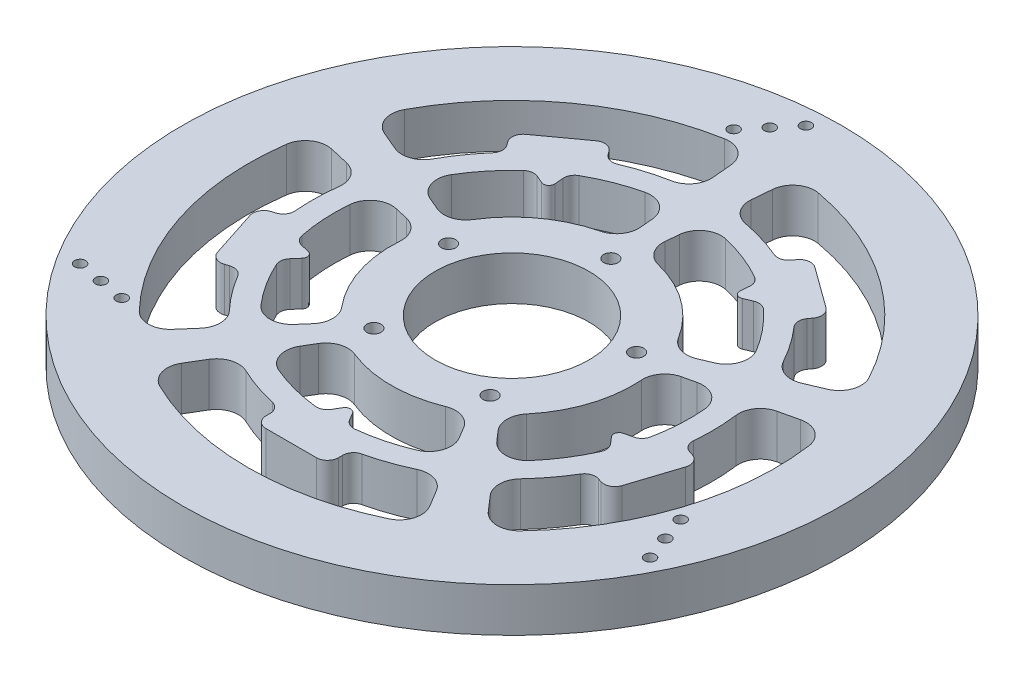
from build123d import *

# Parameters (mm, degrees)
SKETCH1_R           = 150
SKETCH1_R_2         = 35
BOSS_EXTRUDE1_DEPTH = 20
CUT_EXTRUDE6_START  = -214.072757527
SKETCH2_R           = 2.5
CUT_EXTRUDE6_DEPTH  = 234.072757527
CIRPATTERN1_COUNT   = 3
CUT_EXTRUDE8_DEPTH  = 20
CUT_EXTRUDE9_DEPTH  = 20
SKETCH5_R           = 3.25
CUT_EXTRUDE10_DEPTH = 20
CIRPATTERN2_COUNT   = 5


with BuildPart() as part:
    # Sketch1 → Boss-Extrude1 (new body)
    with BuildSketch(Plane(origin=(0, 0, 0), x_dir=(1, 0, 0), z_dir=(0, 1, 0))):
        with Locations(Location((0, 0, 0), (0, 0, 270))):
            Circle(SKETCH1_R)
        with Locations(Location((0, 0, 0), (0, 0, 270))):
            Circle(SKETCH1_R_2, mode=Mode.SUBTRACT)
    extrude(amount=BOSS_EXTRUDE1_DEPTH)

    # Sketch2 → Cut-Extrude6 (cut)
    with BuildSketch(Plane(origin=(0, 0, 0), x_dir=(1, 0, 0), z_dir=(0, 1, 0)).offset(CUT_EXTRUDE6_START)):
        with Locations(Location((-15.507532353, 132.827340134, 0), (0, 0, 270))):
            Circle(SKETCH2_R)
        with Locations(Location((-23.015064706, 123.880211481, 0), (0, 0, 270))):
            Circle(SKETCH2_R)
        with Locations(Location((-8, 141.774468788, 0), (0, 0, 270))):
            Circle(SKETCH2_R)
    cut_extrude6 = extrude(amount=CUT_EXTRUDE6_DEPTH, mode=Mode.SUBTRACT)

    # CirPattern1: Cut-Extrude6 ×3 about axis
    cirpattern1_axis = Axis((0, 0, 0), (0, 1, 0))
    for i in range(1, CIRPATTERN1_COUNT):
        add(cut_extrude6.rotate(cirpattern1_axis, i * 360 / CIRPATTERN1_COUNT), mode=Mode.SUBTRACT)

    # Sketch3 → Cut-Extrude8 (cut)
    with BuildSketch(Plane(origin=(0, 0, 0), x_dir=(1, 0, 0), z_dir=(0, 1, 0))):
        with BuildLine():
            Line((-33.078919295, -55.052566682), (-36.203183619, -60.252215693))
            ThreePointArc((-36.203183619, -60.252215693), (-37.139463352, -68.500795063), (-31.52327267, -74.614229743))
            ThreePointArc((-31.52327267, -74.614229743), (-20.485087241, -78.366837379), (-9.022514243, -80.495926833))
            ThreePointArc((-9.022514243, -80.495926833), (-6.250032845, -80.009385587), (-4.179732416, -78.102232835))
            Line((-4.179732416, -78.102232835), (-2.142918252, -74.712404813))
            ThreePointArc((-2.142918252, -74.712404813), (0, -73.5), (2.142918252, -74.712404813))
            Line((2.142918252, -74.712404813), (4.179732416, -78.102232835))
            ThreePointArc((4.179732416, -78.102232835), (6.250032845, -80.009385587), (9.022514243, -80.495926833))
            ThreePointArc((9.022514243, -80.495926833), (20.485087241, -78.366837379), (31.52327267, -74.614229743))
            ThreePointArc((31.52327267, -74.614229743), (37.139463352, -68.500795063), (36.203183619, -60.252215693))
            Line((36.203183619, -60.252215693), (33.078919295, -55.052566682))
            ThreePointArc((33.078919295, -55.052566682), (27.667866931, -50.715562272), (20.736900706, -50.940955518))
            ThreePointArc((20.736900706, -50.940955518), (0, -55), (-20.736900706, -50.940955518))
            ThreePointArc((-20.736900706, -50.940955518), (-27.667866931, -50.715562272), (-33.078919295, -55.052566682))
        make_face()
    cut_extrude8 = extrude(amount=CUT_EXTRUDE8_DEPTH, mode=Mode.SUBTRACT)

    # Sketch4 → Cut-Extrude9 (cut)
    with BuildSketch(Plane(origin=(0, 0, 0), x_dir=(1, 0, 0), z_dir=(0, 1, 0))):
        with BuildLine():
            Line((-51.763248277, -86.148512047), (-56.41959432, -93.89797323))
            ThreePointArc((-56.41959432, -93.89797323), (-57.430750349, -101.90656805), (-52.197732342, -108.052749795))
            ThreePointArc((-52.197732342, -108.052749795), (0, -120), (52.197732342, -108.052749795))
            ThreePointArc((52.197732342, -108.052749795), (57.430750349, -101.90656805), (56.41959432, -93.89797323))
            Line((56.41959432, -93.89797323), (51.763248277, -86.148512047))
            ThreePointArc((51.763248277, -86.148512047), (46.088756216, -81.72777256), (38.915181679, -82.25939846))
            ThreePointArc((38.915181679, -82.25939846), (29.821453734, -85.97488527), (20.380208333, -88.688483516))
            ThreePointArc((20.380208333, -88.688483516), (17.588545134, -90.446911201), (16.5, -93.561477115))
            Line((16.5, -93.561477115), (16.5, -95.5))
            ThreePointArc((16.5, -95.5), (15.035533906, -99.035533906), (11.5, -100.5))
            Line((11.5, -100.5), (-11.5, -100.5))
            ThreePointArc((-11.5, -100.5), (-15.035533906, -99.035533906), (-16.5, -95.5))
            Line((-16.5, -95.5), (-16.5, -93.561477115))
            ThreePointArc((-16.5, -93.561477115), (-17.588545134, -90.446911201), (-20.380208333, -88.688483516))
            ThreePointArc((-20.380208333, -88.688483516), (-29.821453734, -85.97488527), (-38.915181679, -82.25939846))
            ThreePointArc((-38.915181679, -82.25939846), (-46.088756216, -81.72777256), (-51.763248277, -86.148512047))
        make_face()
    cut_extrude9 = extrude(amount=CUT_EXTRUDE9_DEPTH, mode=Mode.SUBTRACT)

    # Sketch5 → Cut-Extrude10 (cut)
    with BuildSketch(Plane(origin=(0, 0, 0), x_dir=(1, 0, 0), z_dir=(0, 1, 0))):
        with Locations(Location((0, 45, 0), (0, 0, 270))):
            Circle(SKETCH5_R)
    cut_extrude10 = extrude(amount=CUT_EXTRUDE10_DEPTH, mode=Mode.SUBTRACT)

    # CirPattern2: Cut-Extrude8, Cut-Extrude9, Cut-Extrude10 ×5 about axis
    cirpattern2_axis = Axis((0, 0, 0), (0, 1, 0))
    add([cut_extrude8.rotate(cirpattern2_axis, i * 360 / CIRPATTERN2_COUNT) for i in range(1, CIRPATTERN2_COUNT)], mode=Mode.SUBTRACT)
    add([cut_extrude9.rotate(cirpattern2_axis, i * 360 / CIRPATTERN2_COUNT) for i in range(1, CIRPATTERN2_COUNT)], mode=Mode.SUBTRACT)
    add([cut_extrude10.rotate(cirpattern2_axis, i * 360 / CIRPATTERN2_COUNT) for i in range(1, CIRPATTERN2_COUNT)], mode=Mode.SUBTRACT)


solid = part.part
